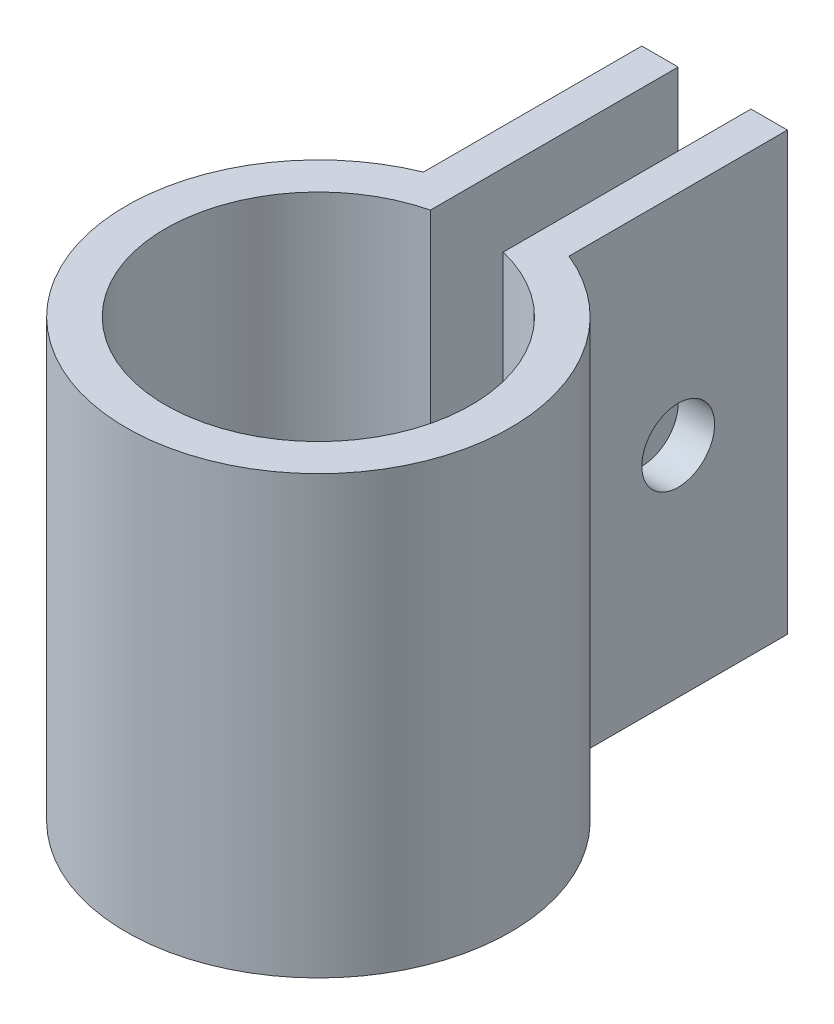
from build123d import *

# Parameters (mm, degrees)
SKETCH1_R           = 16.764
SKETCH1_R_2         = 13.335
BOSS_EXTRUDE1_DEPTH = 38.1
SKETCH2_W           = 6.35
SKETCH2_H           = 3.812490435
CUT_EXTRUDE1_DEPTH  = 45.873972322
SKETCH3_W           = 3.175
SKETCH3_H           = 19.05
BOSS_EXTRUDE2_DEPTH = 38.1
SKETCH4_R           = 3.175
CUT_EXTRUDE2_DEPTH  = 57.396744492


with BuildPart() as part:
    # Sketch1 → Boss-Extrude1 (new body)
    with BuildSketch(Plane(origin=(0, 0, 0), x_dir=(1, 0, 0), z_dir=(0, 1, 0))):
        with Locations(Location((0, 0, 0), (0, 0, 90))):
            Circle(SKETCH1_R)
        with Locations(Location((0, 0, 0), (0, 0, 90))):
            Circle(SKETCH1_R_2, mode=Mode.SUBTRACT)
    extrude(amount=BOSS_EXTRUDE1_DEPTH)

    # Sketch2 → Cut-Extrude1 (cut, through all)
    with BuildSketch(Plane(origin=(0, 38.1, 0), x_dir=(1, 0, 0), z_dir=(0, 1, 0))):
        with Locations((0, 14.857754782)):
            Rectangle(SKETCH2_W, SKETCH2_H)
    extrude(amount=-CUT_EXTRUDE1_DEPTH, mode=Mode.SUBTRACT)

    # Sketch3 → Boss-Extrude2 (add)
    with BuildSketch(Plane(origin=(0, 38.1, 0), x_dir=(1, 0, 0), z_dir=(0, 1, 0))):
        with Locations((-4.7625, 25.039805703)):
            Rectangle(SKETCH3_W, SKETCH3_H)
    boss_extrude2 = extrude(amount=-BOSS_EXTRUDE2_DEPTH)

    # Sketch4 → Cut-Extrude2 (cut, through all)
    with BuildSketch(Plane.ZY.offset(6.35)):
        with Locations((-25.039805703, 19.05)):
            Circle(SKETCH4_R)
    cut_extrude2 = extrude(amount=-CUT_EXTRUDE2_DEPTH, mode=Mode.SUBTRACT)

    # Mirror1: Boss-Extrude2, Cut-Extrude2 across plane
    add(boss_extrude2.mirror(Plane(origin=(0, 0, 0), x_dir=(0, 0, 1), z_dir=(1, 0, 0))))
    add(cut_extrude2.mirror(Plane(origin=(0, 0, 0), x_dir=(0, 0, 1), z_dir=(1, 0, 0))), mode=Mode.SUBTRACT)


solid = part.part
